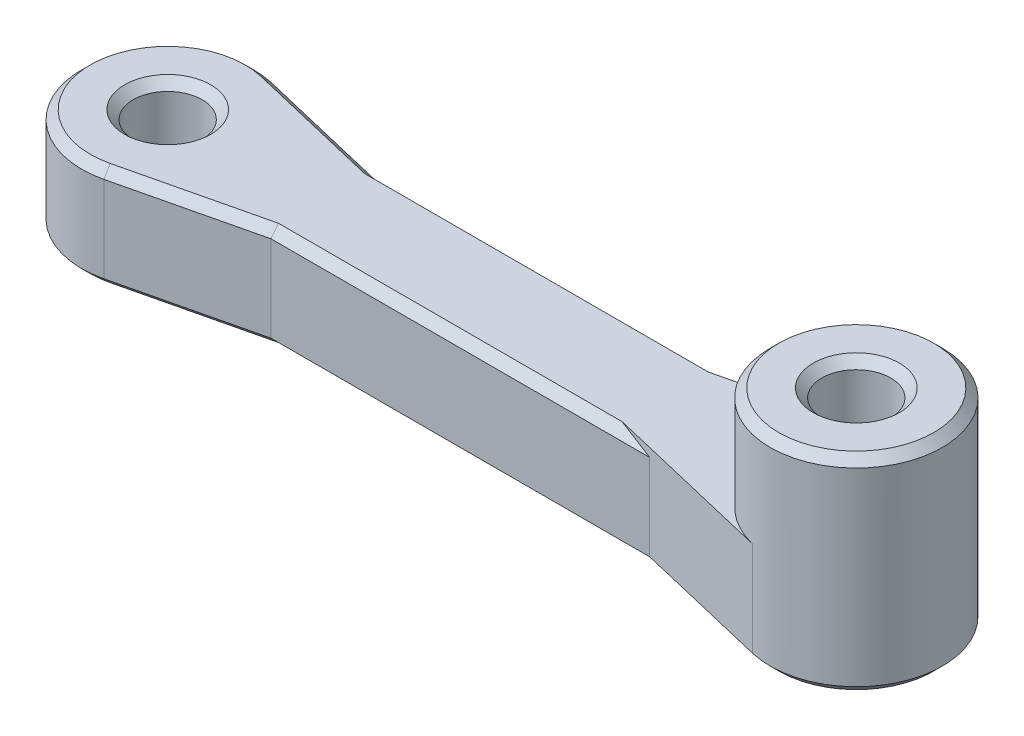
from build123d import *

# Parameters (mm, degrees)
EXTRUDE_1_DEPTH     = 3
SKETCH_2_R          = 1
CUT_EXTRUDE_1_DEPTH = 3
EXTRUDE_2_DEPTH     = 3
CHAMFER_1_SIZE      = 0.25
EXTRUDE_START       = 3
SKETCH_4_R          = 2.5
SKETCH_4_R_2        = 1
EXTRUDE_3_DEPTH     = 3
CHAMFER_3_SIZE      = 0.25


with BuildPart() as part:
    # 草图1 → 凸台-拉伸1 (new body)
    with BuildSketch(Plane(origin=(0, 0, 0), x_dir=(1, 0, 0), z_dir=(0, 1, 0))):
        with BuildLine():
            Line((2, 1.5), (18, 1.5))
            ThreePointArc((18, 1.5), (22.5, 0), (18, -1.5))
            Line((18, -1.5), (2, -1.5))
            ThreePointArc((2, -1.5), (-2.5, 0), (2, 1.5))
        make_face()
    extrude(amount=EXTRUDE_1_DEPTH)

    # 草图2 → 切除-拉伸1 (cut)
    with BuildSketch(Plane(origin=(0, 0, 0), x_dir=(1, 0, 0), z_dir=(0, 1, 0))):
        with Locations(Location((0, 0, 0), (0, 0, 270))):
            Circle(SKETCH_2_R)
        with Locations(Location((20, 0, 0), (0, 0, 270))):
            Circle(SKETCH_2_R)
    extrude(amount=CUT_EXTRUDE_1_DEPTH, mode=Mode.SUBTRACT)

    # 草图3 → 凸台-拉伸2 (add)
    with BuildSketch(Plane(origin=(0, 0, 0), x_dir=(1, 0, 0), z_dir=(0, 1, 0))):
        with BuildLine():
            Line((4.5, 1.5), (0.578145188, 2.432231104))
            ThreePointArc((0.578145188, 2.432231104), (1.370755945, 2.090700395), (2, 1.5))
            Line((2, 1.5), (4.5, 1.5))
        make_face()
        with BuildLine():
            Line((4.5, -1.5), (0.578145188, -2.432231104))
            ThreePointArc((0.578145188, -2.432231104), (1.370755945, -2.090700395), (2, -1.5))
            Line((2, -1.5), (4.5, -1.5))
        make_face()
        with BuildLine():
            Line((18, 1.5), (15.5, 1.5))
            Line((15.5, 1.5), (19.421854812, 2.432231104))
            ThreePointArc((19.421854812, 2.432231104), (18.629244055, 2.090700395), (18, 1.5))
        make_face()
        with BuildLine():
            Line((15.5, -1.5), (19.421854812, -2.432231104))
            ThreePointArc((19.421854812, -2.432231104), (18.629244055, -2.090700395), (18, -1.5))
            Line((18, -1.5), (15.5, -1.5))
        make_face()
    extrude(amount=EXTRUDE_2_DEPTH)

    # 倒角1
    chamfer_1_edges = [part.edges().sort_by_distance(p)[0] for p in [
        (0, 0, -1),
        (20, 0, -1),
        (-2.5, 0, 0),
        (2.539072594, 0, -1.966115552),
        (10, 0, 1.5),
        (2.539072594, 0, 1.966115552),
        (22.5, 0, 0),
        (17.460927406, 0, 1.966115552),
        (10, 0, -1.5),
        (17.460927406, 0, -1.966115552),
    ]]
    chamfer(chamfer_1_edges, length=CHAMFER_1_SIZE)

    # 草图4 → 凸台-拉伸3 (add)
    with BuildSketch(Plane(origin=(0, 0, 0), x_dir=(1, 0, 0), z_dir=(0, 1, 0)).offset(EXTRUDE_START)):
        with Locations(Location((20, 0, 0), (0, 0, 103.371151196))):
            Circle(SKETCH_4_R)
        with Locations(Location((20, 0, 0), (0, 0, 270))):
            Circle(SKETCH_4_R_2, mode=Mode.SUBTRACT)
    extrude(amount=EXTRUDE_3_DEPTH)

    # 倒角3
    chamfer_3_edges = [part.edges().sort_by_distance(p)[0] for p in [
        (0, 3, -1),
        (-2.5, 3, 0),
        (2.539072594, 3, -1.966115552),
        (10, 3, 1.5),
        (2.539072594, 3, 1.966115552),
        (10, 3, -1.5),
        (20.578145188, 6, 2.432231104),
        (20, 6, -1),
    ]]
    chamfer(chamfer_3_edges, length=CHAMFER_3_SIZE)


solid = part.part
